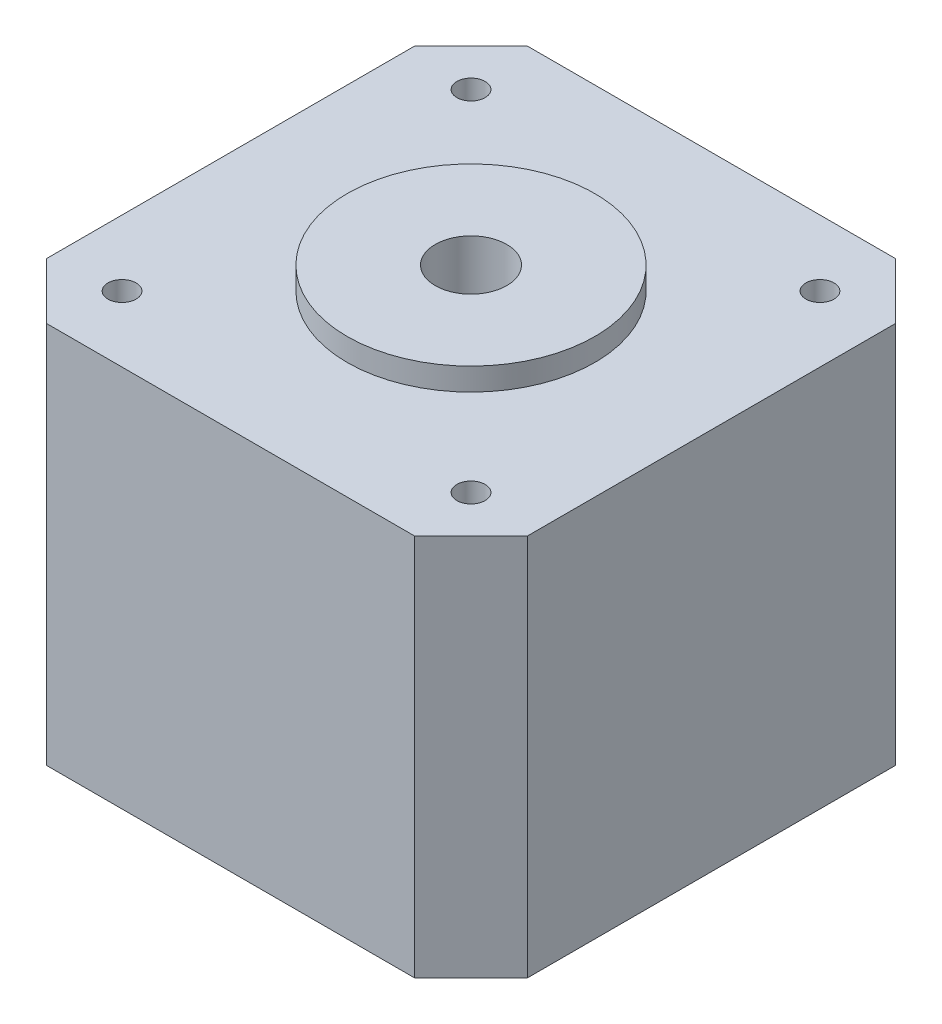
from build123d import *

# Parameters (mm, degrees)
SKETCH1_W             = 42.7
SKETCH1_H             = 42.7
BOSS_EXTRUDE1_DEPTH   = 34
SKETCH2_R             = 11
BOSS_EXTRUDE2_DEPTH   = 2
SKETCH3_R             = 3.175
CUT_EXTRUDE1_DEPTH    = 47.985582895
M3_TAPPED_HOLE1_D     = 2.5
M3_TAPPED_HOLE1_DEPTH = 7.5
M3_TAPPED_HOLE1_TIP   = 0.751075774
CHAMFER1_SIZE         = 5


with BuildPart() as part:
    # Sketch1 → Boss-Extrude1 (new body)
    with BuildSketch(Plane(origin=(0, 0, 0), x_dir=(1, 0, 0), z_dir=(0, 1, 0))):
        Rectangle(SKETCH1_W, SKETCH1_H)
    extrude(amount=BOSS_EXTRUDE1_DEPTH)

    # Sketch2 → Boss-Extrude2 (add)
    with BuildSketch(Plane(origin=(0, 34, 0), x_dir=(1, 0, 0), z_dir=(0, 1, 0))):
        with Locations(Location((0, 0, 0), (0, 0, 270))):
            Circle(SKETCH2_R)
    extrude(amount=BOSS_EXTRUDE2_DEPTH)

    # Sketch3 → Cut-Extrude1 (cut, through all)
    with BuildSketch(Plane(origin=(0, 36, 0), x_dir=(1, 0, 0), z_dir=(0, 1, 0))):
        with Locations(Location((0, 0, 0), (0, 0, 270))):
            Circle(SKETCH3_R)
    extrude(amount=-CUT_EXTRUDE1_DEPTH, mode=Mode.SUBTRACT)

    # M3 Tapped Hole1
    with Locations(Plane(origin=(0, 34, 0), x_dir=(1, 0, 0), z_dir=(0, 1, 0))):
        with Locations((15.5, 15.5), (-15.5, -15.5), (-15.5, 15.5), (15.5, -15.5)):
            Hole(M3_TAPPED_HOLE1_D / 2, depth=M3_TAPPED_HOLE1_DEPTH)
            with Locations((0, 0, -(M3_TAPPED_HOLE1_DEPTH + M3_TAPPED_HOLE1_TIP / 2))):  # 118° drill point
                Cone(0, M3_TAPPED_HOLE1_D / 2, M3_TAPPED_HOLE1_TIP, mode=Mode.SUBTRACT)

    # Chamfer1
    chamfer1_edges = [part.edges().sort_by_distance(p)[0] for p in [
        (21.35, 17, 21.35),
        (-21.35, 17, 21.35),
        (-21.35, 17, -21.35),
        (21.35, 17, -21.35),
    ]]
    chamfer(chamfer1_edges, length=CHAMFER1_SIZE)


solid = part.part
